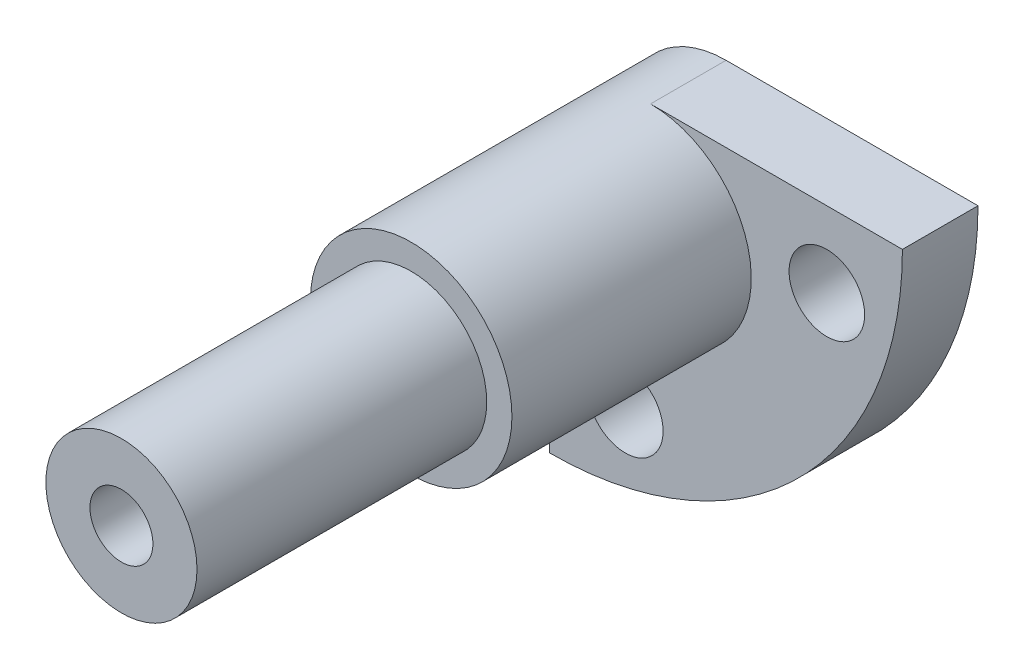
from build123d import *

# Parameters (mm, degrees)
EXTRUDE1_DEPTH        = 3
SKETCH2_R             = 4
EXTRUDE2_DEPTH        = 9.5
SKETCH3_R             = 3
EXTRUDE3_DEPTH        = 11.5
SKETCH4_R             = 1.25
EXTRUDE4_DEPTH        = 10
SKETCH5_R             = 1.5
EXTRUDE5_DEPTH        = 3
M3_TAPPED_HOLE1_D     = 2.5
M3_TAPPED_HOLE1_DEPTH = 7.5
M3_TAPPED_HOLE1_TIP   = 0.751075774


with BuildPart() as part:
    # Sketch1 → Extrude1 (new body)
    with BuildSketch(Plane.XY):
        with BuildLine():
            Line((10, 4), (0, 4))
            ThreePointArc((0, 4), (-2.828427125, 2.828427125), (-4, 0))
            Line((-4, 0), (-4, -10))
            ThreePointArc((-4, -10), (5.899494937, -5.899494937), (10, 4))
        make_face()
    extrude(amount=EXTRUDE1_DEPTH)

    # Sketch2 → Extrude2 (add)
    with BuildSketch(Plane.XY.offset(3)):
        with Locations(Location((0, 0, 0), (0, 0, 180))):
            Circle(SKETCH2_R)
    extrude(amount=EXTRUDE2_DEPTH)

    # Sketch3 → Extrude3 (add)
    with BuildSketch(Plane.XY.offset(12.5)):
        Circle(SKETCH3_R)
    extrude(amount=EXTRUDE3_DEPTH)

    # Sketch4 → Extrude4 (cut)
    with BuildSketch(Plane.XY.offset(24)):
        Circle(SKETCH4_R)
    extrude(amount=-EXTRUDE4_DEPTH, mode=Mode.SUBTRACT)

    # Sketch5 → Extrude5 (cut)
    with BuildSketch(Plane.XY.offset(3)):
        with Locations((7, 1)):
            Circle(SKETCH5_R)
        with Locations((-1, -7)):
            Circle(SKETCH5_R)
    extrude(amount=-EXTRUDE5_DEPTH, mode=Mode.SUBTRACT)

    # M3 Tapped Hole1
    with Locations(Plane.XY.offset(24)):
        with Locations((0, 0)):
            Hole(M3_TAPPED_HOLE1_D / 2, depth=M3_TAPPED_HOLE1_DEPTH)
            with Locations((0, 0, -(M3_TAPPED_HOLE1_DEPTH + M3_TAPPED_HOLE1_TIP / 2))):  # 118° drill point
                Cone(0, M3_TAPPED_HOLE1_D / 2, M3_TAPPED_HOLE1_TIP, mode=Mode.SUBTRACT)


solid = part.part
